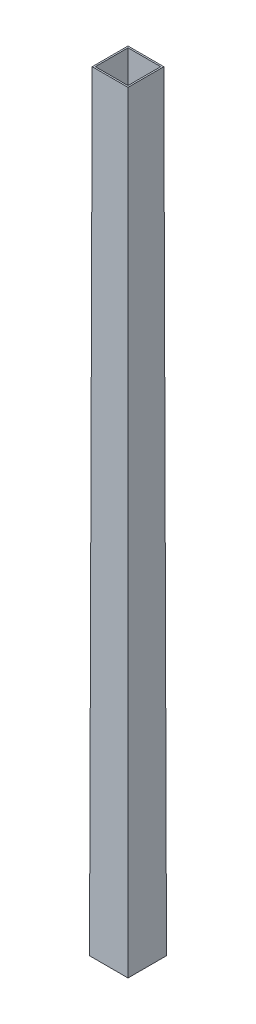
from build123d import *

# Parameters (mm, degrees)
SHELL_1_T = -0.2


with BuildPart() as part:
    # 草图2 → 放样1 section 0
    with BuildSketch(Plane(origin=(0, 100, 0), x_dir=(1, 0, 0), z_dir=(0, 1, 0))):
        with BuildLine():
            Line((-2.325466898, 2.325466898), (2.325466898, 2.325466898))
            Line((2.325466898, 2.325466898), (2.325466898, -2.325466898))
            Line((2.325466898, -2.325466898), (-2.325466898, -2.325466898))
            Line((-2.325466898, -2.325466898), (-2.325466898, 2.325466898))
        make_face()
    # 草图1 → 放样1 section 1
    with BuildSketch(Plane(origin=(0, 0, 0), x_dir=(1, 0, 0), z_dir=(0, 1, 0))):
        with BuildLine():
            Line((-2.5, 2.5), (2.5, 2.5))
            Line((2.5, 2.5), (2.5, -2.5))
            Line((2.5, -2.5), (-2.5, -2.5))
            Line((-2.5, -2.5), (-2.5, 2.5))
        make_face()
    loft()

    # 抽壳1
    shell_1_openings = [part.faces().sort_by_distance(p)[0] for p in [
        (0, 0, 0),
        (0, 100, 0),
    ]]
    offset(amount=SHELL_1_T, openings=shell_1_openings, kind=Kind.INTERSECTION)


solid = part.part
